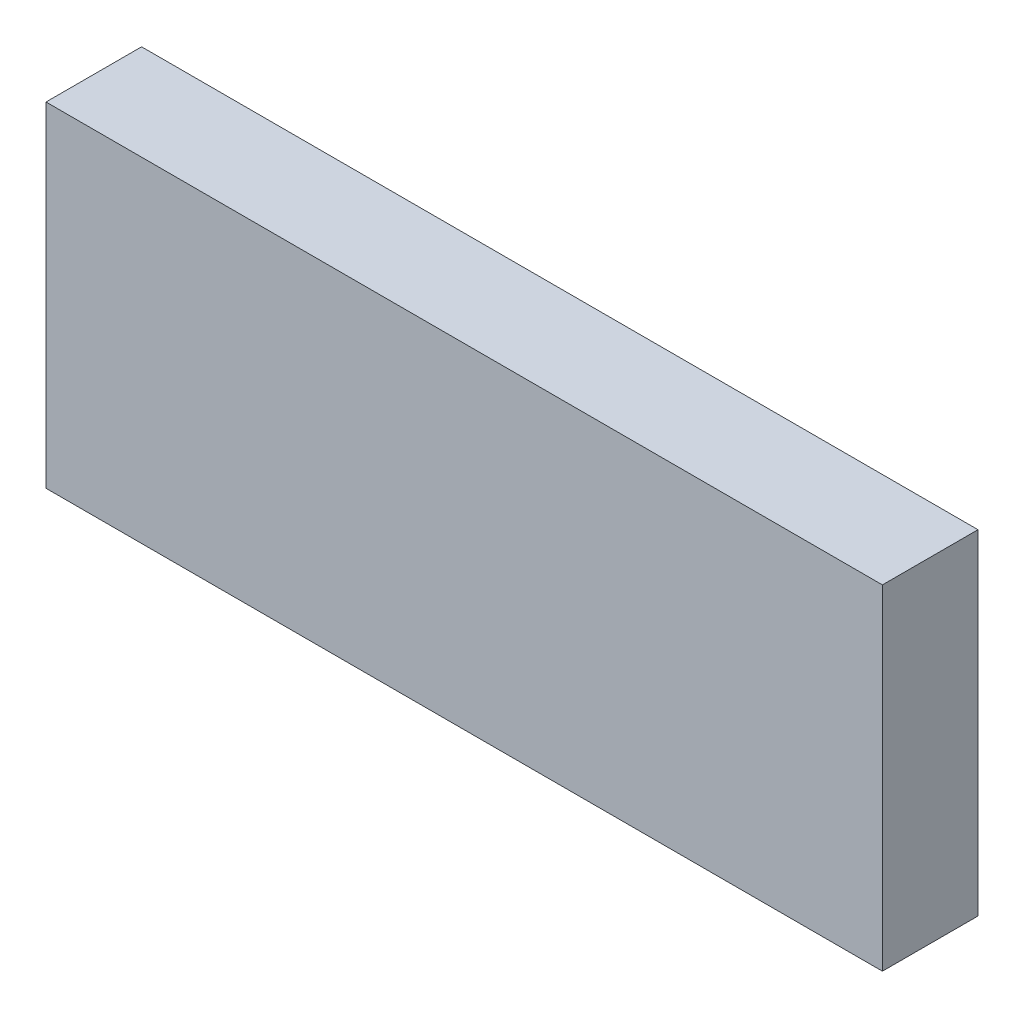
from build123d import *

# Parameters (mm, degrees)
SKETCH_1_W                  = 35
SKETCH_1_H                  = 14
V2_REF_GRIPPER_FINGER_DEPTH = 4


with BuildPart() as part:
    # 草图1 → V2_REF_gripper_finger (new body)
    with BuildSketch(Plane.XY):
        with Locations((17.5, 7)):
            Rectangle(SKETCH_1_W, SKETCH_1_H)
    extrude(amount=V2_REF_GRIPPER_FINGER_DEPTH)


solid = part.part
